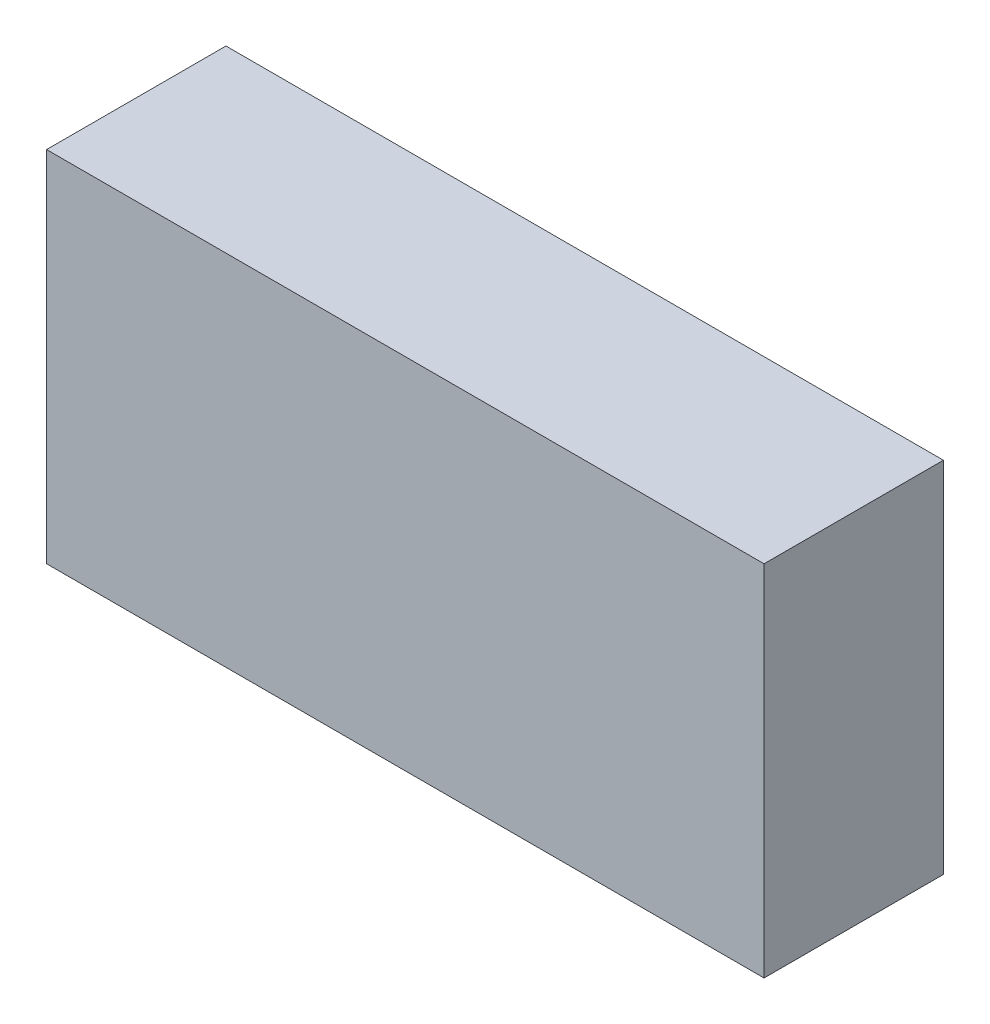
from build123d import *

# Parameters (mm, degrees)
SKETCH1_W      = 203.2
SKETCH1_H      = 101.6
EXTRUDE1_DEPTH = 50.8


with BuildPart() as part:
    # Sketch1 → Extrude1 (new body)
    with BuildSketch(Plane.XY):
        with Locations((101.6, 50.8)):
            Rectangle(SKETCH1_W, SKETCH1_H)
    extrude(amount=EXTRUDE1_DEPTH)


solid = part.part
